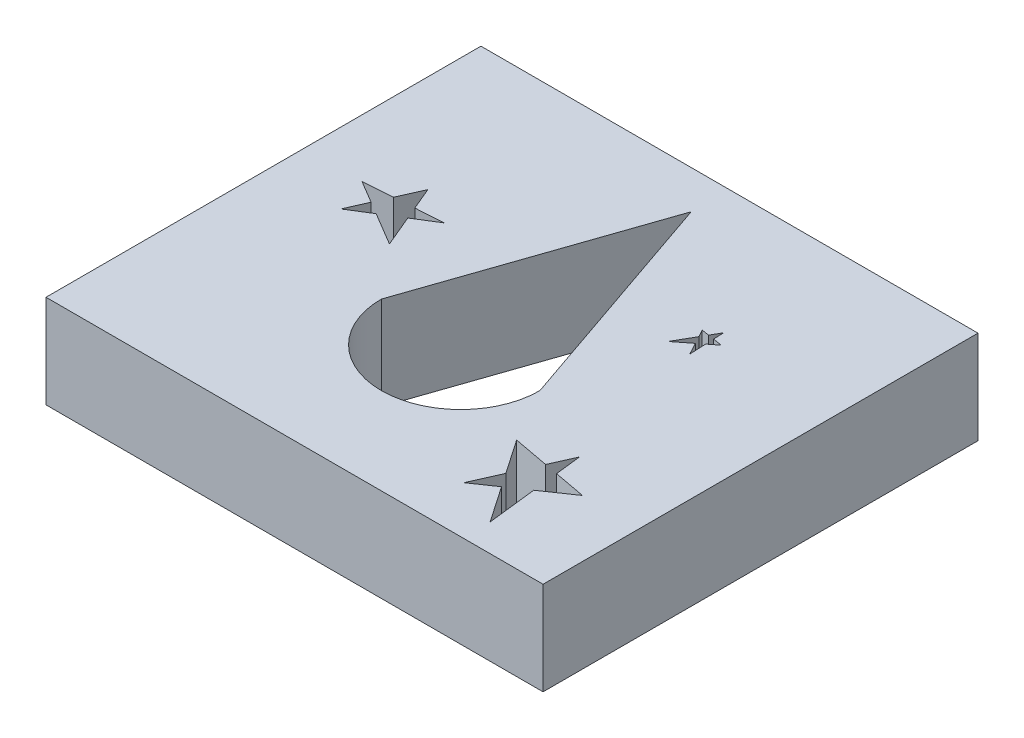
from build123d import *

# Parameters (mm, degrees)
SKETCH1_W           = 16
SKETCH1_H           = 14
BOSS_EXTRUDE1_DEPTH = 3


with BuildPart() as part:
    # Sketch1 → Boss-Extrude1 (new body)
    with BuildSketch(Plane(origin=(0, 0, 0), x_dir=(1, 0, 0), z_dir=(0, 1, 0))):
        with Locations((-34.802547771, 15.318471338)):
            Rectangle(SKETCH1_W, SKETCH1_H)
        with BuildLine():
            Line((-34.802547771, 21.085939893), (-37.354294581, 13.665043558))
            ThreePointArc((-37.354294581, 13.665043558), (-34.802547771, 11.113296747), (-32.250800961, 13.665043558))
            Line((-32.250800961, 13.665043558), (-34.802547771, 21.085939893))
        make_face(mode=Mode.SUBTRACT)
        Polygon((-39.65867818, 17.46662554), (-39.999163851, 16.697953343), (-40.947570701, 16.633402092), (-40.219675658, 16.200131233), (-40.517939861, 15.5267772), (-39.817900069, 15.960979096), (-38.76035915, 15.331490454), (-39.189256036, 16.350897547), (-38.460919473, 16.802650605), (-39.353755451, 16.741881664), align=None, mode=Mode.SUBTRACT)
        Polygon((-29.764149732, 12.454265734), (-30.098857658, 11.698637236), (-31.248127998, 11.913183956), (-30.492306767, 10.810396065), (-30.906618006, 9.875057055), (-30.188552158, 10.36720012), (-29.391182209, 9.203790192), (-29.573076572, 10.789030573), (-28.642568323, 11.42677596), (-29.668222777, 11.618245966), align=None, mode=Mode.SUBTRACT)
        Polygon((-30.906618006, 18.234753406), (-31.083034427, 17.927114996), (-31.326443698, 17.965418816), (-31.197762972, 17.727049113), (-31.558988429, 17.097137085), (-31.066185401, 17.48331326), (-30.857713309, 17.097137085), (-30.880567513, 17.628769359), (-30.59737318, 17.850689473), (-30.892101379, 17.897069037), align=None, mode=Mode.SUBTRACT)
    extrude(amount=BOSS_EXTRUDE1_DEPTH)


solid = part.part
